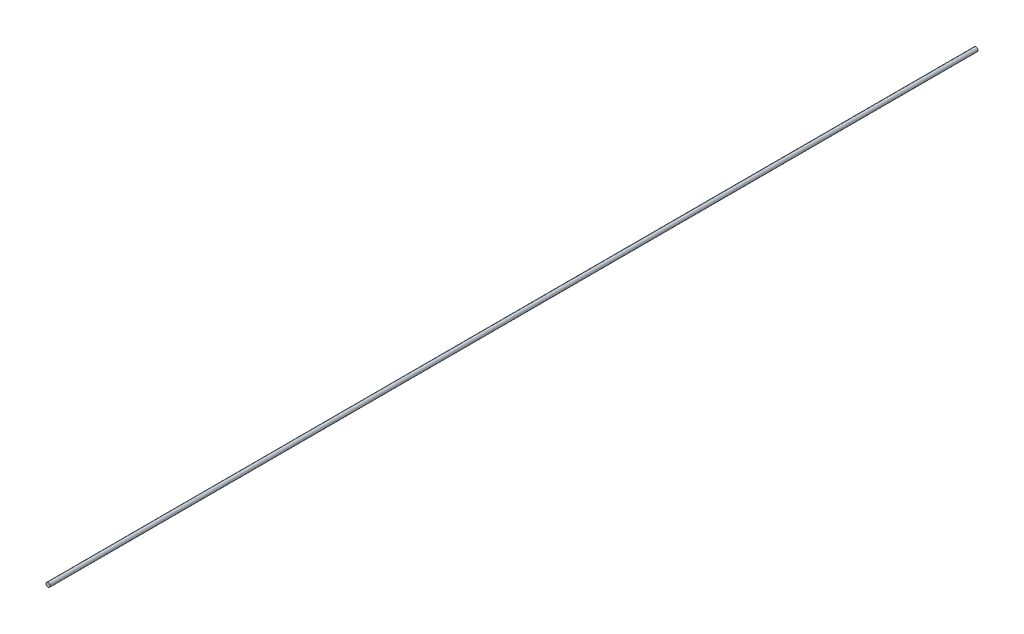
from build123d import *

# Parameters (mm, degrees)
SKETCH1_R           = 2
BOSS_EXTRUDE1_DEPTH = 900


with BuildPart() as part:
    # Sketch1 → Boss-Extrude1 (new body)
    with BuildSketch(Plane.XY):
        Circle(SKETCH1_R)
    extrude(amount=BOSS_EXTRUDE1_DEPTH)


solid = part.part
